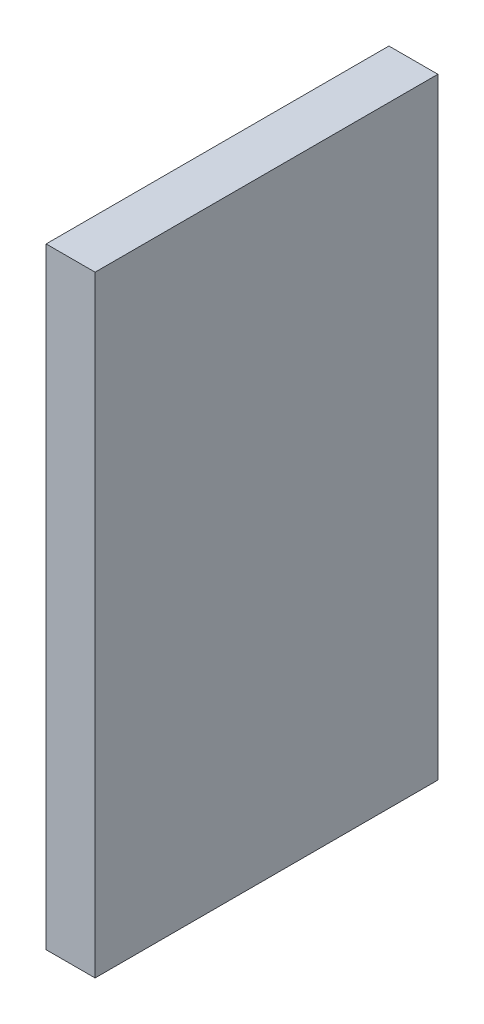
from build123d import *

# Parameters (mm, degrees)
SKETCH1_W           = 35.015378823
SKETCH1_H           = 62.440011187
BOSS_EXTRUDE1_DEPTH = 5


with BuildPart() as part:
    # Sketch1 → Boss-Extrude1 (new body)
    with BuildSketch(Plane(origin=(14.362114276, 0, 0), x_dir=(0, 0, -1), z_dir=(1, 0, 0))):
        with Locations((-741.36619463, 255.537584572)):
            Rectangle(SKETCH1_W, SKETCH1_H)
    extrude(amount=BOSS_EXTRUDE1_DEPTH)


solid = part.part
